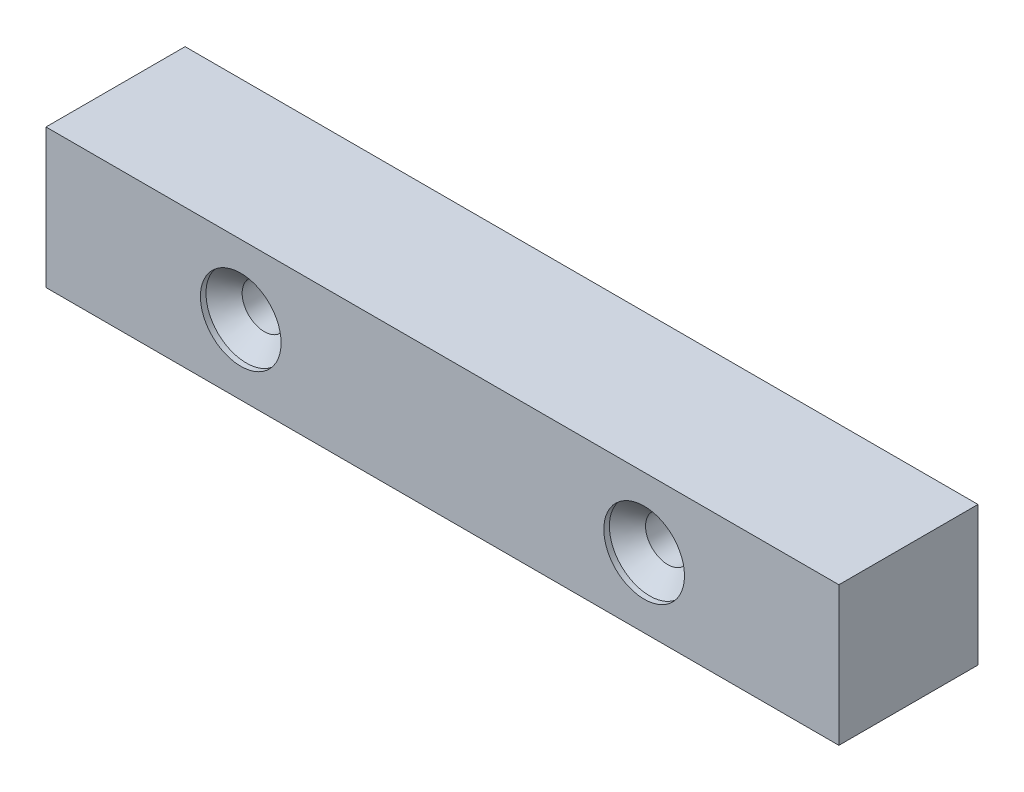
from build123d import *

# Parameters (mm, degrees)
ESQUISSE1_W                              = 57
ESQUISSE1_H                              = 10
BOSS_EXTRU_1_DEPTH                       = 10
FRAISAGE_POUR_VIS_T_TE_FRAIS_E_6_2_COUNT = 2
FRAISAGE_POUR_VIS_T_TE_FRAIS_E_6_2_PITCH = 29
ESQUISSE8_R                              = 1.55
ENL_V_MAT_EXTRU_1_DEPTH                  = 5


with BuildPart() as part:
    # Esquisse1 → Boss.-Extru.1 (new body)
    with BuildSketch(Plane.XY):
        with Locations((0, -22.219493411)):
            Rectangle(ESQUISSE1_W, ESQUISSE1_H)
    extrude(amount=BOSS_EXTRU_1_DEPTH)

    # Esquisse6 → Fraisage pour vis à tête fraisée à 6 pans creux M31 (revolve, cut)
    with BuildSketch(Plane(origin=(-14.5, -22.219493411, 10), x_dir=(0, -1, 0), z_dir=(1, 0, 0))):
        Polygon((0, 0), (0, 10), (1.6, 10), (1.6, 1.7), (2.9, 0.4), (2.9, 0), align=None)
    fraisage_pour_vis_t_te_frais_e_6_pan = revolve(axis=Axis((-14.5, -22.219493411, 16.35), (0, 0, -1)), mode=Mode.SUBTRACT)

    # Fraisage pour vis _ t_te frais_e _ 6 2: Fraisage pour vis à tête fraisée à 6 pans creux M31 ×2
    with Locations(*[(i * FRAISAGE_POUR_VIS_T_TE_FRAIS_E_6_2_PITCH, 0, 0) for i in range(1, FRAISAGE_POUR_VIS_T_TE_FRAIS_E_6_2_COUNT)]):
        add(fraisage_pour_vis_t_te_frais_e_6_pan, mode=Mode.SUBTRACT)

    # Esquisse8 → Enlèv. mat.-Extru.1 (cut)
    with BuildSketch(Plane(origin=(0, 0, 0), x_dir=(-1, 0, 0), z_dir=(0, 0, -1))):
        with Locations((-23.5, -22.219493411)):
            Circle(ESQUISSE8_R)
    enl_v_mat_extru_1 = extrude(amount=-ENL_V_MAT_EXTRU_1_DEPTH, mode=Mode.SUBTRACT)

    # Symétrie1: Enlèv. mat.-Extru.1 across plane
    add(enl_v_mat_extru_1.mirror(Plane(origin=(0, 0, 0), x_dir=(0, 0, 1), z_dir=(1, 0, 0))), mode=Mode.SUBTRACT)


solid = part.part
